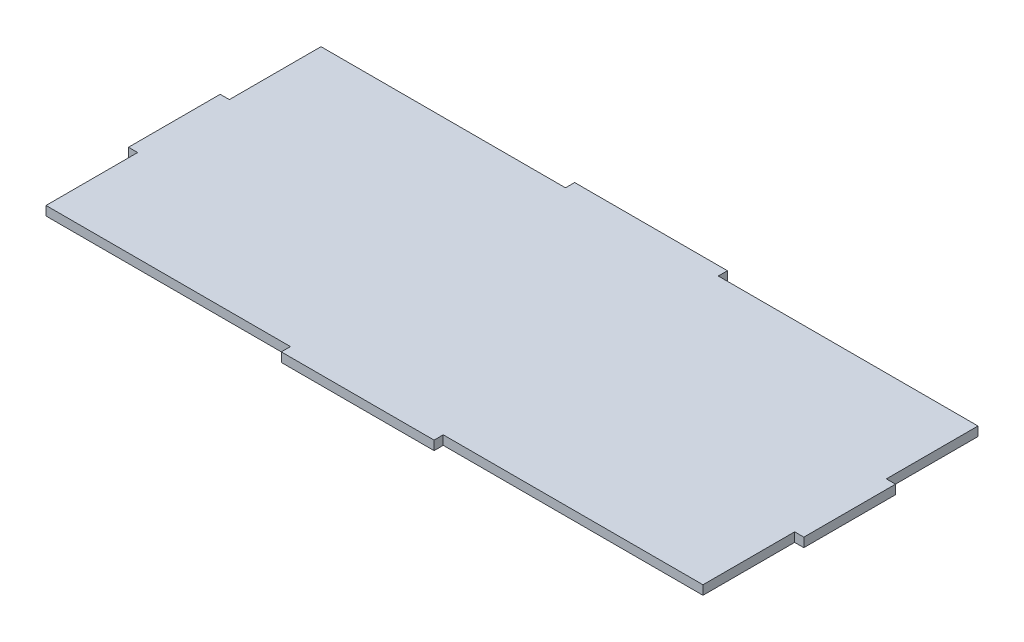
from build123d import *

# Parameters (mm, degrees)
BOSS_EXTRUDE1_DEPTH = 3


with BuildPart() as part:
    # Sketch1 → Boss-Extrude1 (new body)
    with BuildSketch(Plane(origin=(0, 0, 0), x_dir=(1, 0, 0), z_dir=(0, 1, 0))):
        Polygon((130, 90), (215, 90), (215, 60), (218, 60), (218, 30), (215, 30), (215, 0), (130, 0), (130, -3), (80, -3), (80, 0), (0, 0), (0, 30), (-3, 30), (-3, 60), (0, 60), (0, 90), (80, 90), (80, 93), (130, 93), align=None)
    extrude(amount=BOSS_EXTRUDE1_DEPTH)


solid = part.part
